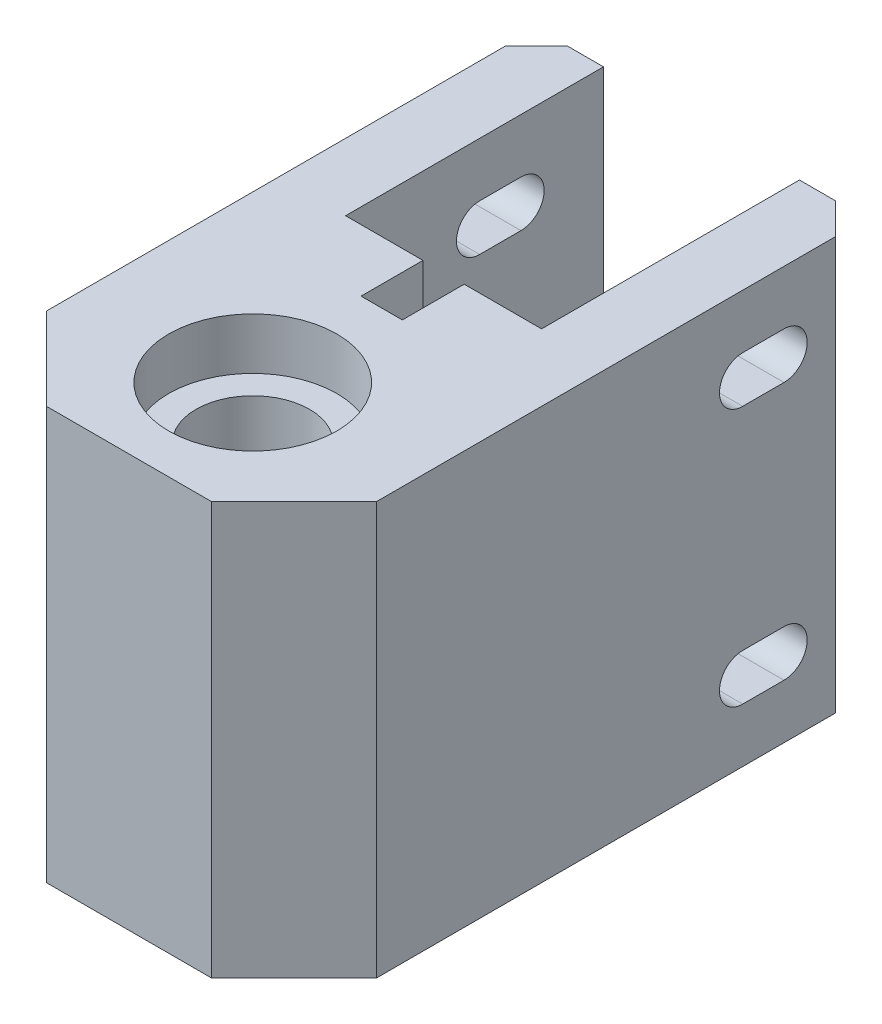
from build123d import *

# Parameters (mm, degrees)
SKETCH1_R           = 5.5
BOSS_EXTRUDE1_DEPTH = 20
SKETCH2_R           = 8.15
CUT_EXTRUDE1_DEPTH  = 5
CUT_EXTRUDE2_DEPTH  = 58.586890869


with BuildPart() as part:
    # Sketch1 → Boss-Extrude1 (new, symmetric)
    with BuildSketch(Plane(origin=(0, 0, 0), x_dir=(1, 0, 0), z_dir=(0, 1, 0))):
        Polygon((-9.5, 43.5), (-9.5, 18.5), (-2, 18.5), (-2, 12.5), (2, 12.5), (2, 18.5), (9.5, 18.5), (9.5, 43.5), (13, 43.5), (16, 40.5), (16, -4), (8, -12), (-8, -12), (-16, -4), (-16, 40.5), (-13, 43.5), align=None)
        with Locations(Location((0, 0, 0), (0, 0, 270))):
            Circle(SKETCH1_R, mode=Mode.SUBTRACT)
    extrude(amount=BOSS_EXTRUDE1_DEPTH, both=True)

    # Sketch2 → Cut-Extrude1 (cut)
    with BuildSketch(Plane(origin=(0, 20, 0), x_dir=(1, 0, 0), z_dir=(0, 1, 0))):
        with Locations(Location((0, 0, 0), (0, 0, 270))):
            Circle(SKETCH2_R)
    cut_extrude1 = extrude(amount=-CUT_EXTRUDE1_DEPTH, mode=Mode.SUBTRACT)

    # Mirror1: Cut-Extrude1 across plane
    add(cut_extrude1.mirror(Plane.ZX), mode=Mode.SUBTRACT)

    # Sketch3 → Cut-Extrude2 (cut, through all)
    with BuildSketch(Plane(origin=(16, 0, 0), x_dir=(0, 0, -1), z_dir=(1, 0, 0))):
        with BuildLine():
            Line((35.5, 10.25), (31.5, 10.25))
            ThreePointArc((31.5, 10.25), (29.25, 12.5), (31.5, 14.75))
            Line((31.5, 14.75), (35.5, 14.75))
            ThreePointArc((35.5, 14.75), (37.75, 12.5), (35.5, 10.25))
        make_face()
        with BuildLine():
            Line((35.5, -14.75), (31.5, -14.75))
            ThreePointArc((31.5, -14.75), (29.25, -12.5), (31.5, -10.25))
            Line((31.5, -10.25), (35.5, -10.25))
            ThreePointArc((35.5, -10.25), (37.75, -12.5), (35.5, -14.75))
        make_face()
    extrude(amount=-CUT_EXTRUDE2_DEPTH, mode=Mode.SUBTRACT)


solid = part.part
